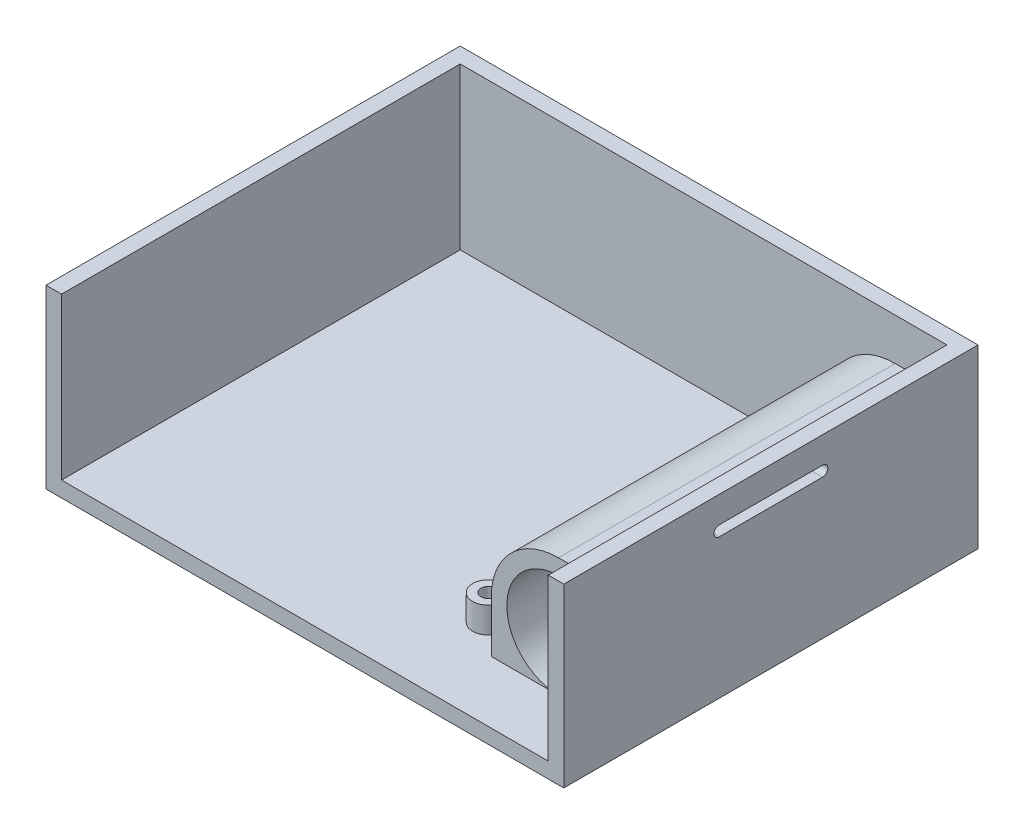
from build123d import *

# Parameters (mm, degrees)
SKETCH1_W           = 100
SKETCH1_H           = 80
BOSS_EXTRUDE1_DEPTH = 3
BOSS_EXTRUDE2_DEPTH = 31.1
BOSS_EXTRUDE3_DEPTH = 65
SKETCH4_R           = 3
SKETCH4_R_2         = 1.425
BOSS_EXTRUDE4_DEPTH = 5
LPATTERN1_COUNT     = 2
LPATTERN1_PITCH     = 44.6
CUT_EXTRUDE1_DEPTH  = 111.325926237


with BuildPart() as part:
    # Sketch1 → Boss-Extrude1 (new body)
    with BuildSketch(Plane(origin=(0, 0, 0), x_dir=(1, 0, 0), z_dir=(0, 1, 0))):
        Rectangle(SKETCH1_W, SKETCH1_H)
    extrude(amount=BOSS_EXTRUDE1_DEPTH)

    # Sketch2 → Boss-Extrude2 (add)
    with BuildSketch(Plane(origin=(0, 3, 0), x_dir=(1, 0, 0), z_dir=(0, 1, 0))):
        Polygon((-50, 40), (50, 40), (50, -40), (47, -40), (47, 37), (-47, 37), (-47, -40), (-50, -40), align=None)
    extrude(amount=BOSS_EXTRUDE2_DEPTH)

    # Sketch3 → Boss-Extrude3 (add)
    with BuildSketch(Plane.XY.offset(-37)):
        with BuildLine():
            Line((47, 26), (37, 26))
            ThreePointArc((37, 26), (27.807611845, 22.192388155), (24, 13))
            Line((24, 13), (24, 3))
            Line((24, 3), (37, 3))
            ThreePointArc((37, 3), (29.928932188, 20.071067812), (47, 13))
            Line((47, 13), (47, 26))
        make_face()
        with BuildLine():
            Line((47, 3), (47, 13))
            ThreePointArc((47, 13), (44.071067812, 5.928932188), (37, 3))
            Line((37, 3), (47, 3))
        make_face()
    extrude(amount=BOSS_EXTRUDE3_DEPTH)

    # Sketch4 → Boss-Extrude4 (add)
    with BuildSketch(Plane(origin=(0, 3, 0), x_dir=(1, 0, 0), z_dir=(0, 1, 0))):
        with Locations(Location((18, 22, 0), (0, 0, 90))):
            Circle(SKETCH4_R)
        with Locations(Location((18, 22, 0), (0, 0, 270))):
            Circle(SKETCH4_R_2, mode=Mode.SUBTRACT)
    boss_extrude4 = extrude(amount=BOSS_EXTRUDE4_DEPTH)

    # LPattern1: Boss-Extrude4 ×2
    with Locations(*[(0, 0, i * LPATTERN1_PITCH) for i in range(1, LPATTERN1_COUNT)]):
        add(boss_extrude4)

    # Sketch10 → Cut-Extrude1 (cut, through all)
    with BuildSketch(Plane.ZY.offset(-47)):
        with BuildLine():
            Line((-10, 29), (10, 29))
            ThreePointArc((10, 29), (11, 28), (10, 27))
            Line((10, 27), (-10, 27))
            ThreePointArc((-10, 27), (-11, 28), (-10, 29))
        make_face()
    extrude(amount=-CUT_EXTRUDE1_DEPTH, mode=Mode.SUBTRACT)


solid = part.part
